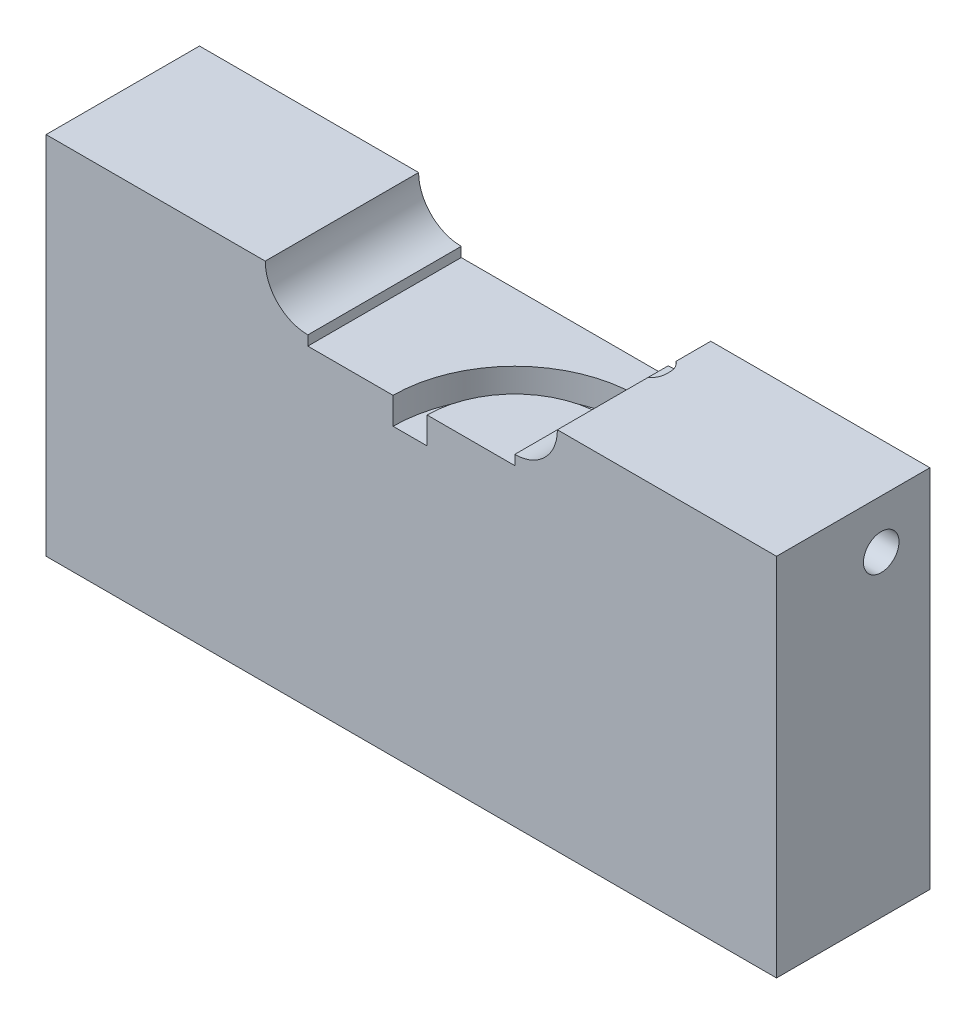
from build123d import *

# Parameters (mm, degrees)
SKETCH1_W               = 38.1
SKETCH1_H               = 8.001
BOSS_EXTRUDE1_DEPTH     = 19.05
CUT_EXTRUDE1_DEPTH      = 25.4
CUT_EXTRUDE2_DEPTH      = 26.730745355
CUT_EXTRUDE2_DEPTH_BACK = 1.905
SKETCH5_R               = 0.9271
CUT_EXTRUDE3_DEPTH      = 12.7
SKETCH6_W               = 10.795
SKETCH6_H               = 8.001
CUT_EXTRUDE4_DEPTH      = 0.508


with BuildPart() as part:
    # Sketch1 → Boss-Extrude1 (new body)
    with BuildSketch(Plane(origin=(0, 0, 0), x_dir=(1, 0, 0), z_dir=(0, 1, 0))):
        Rectangle(SKETCH1_W, SKETCH1_H)
    extrude(amount=BOSS_EXTRUDE1_DEPTH)

    # Sketch2 → Cut-Extrude1 (cut)
    with BuildSketch(Plane(origin=(0, 0, -4.0005), x_dir=(-1, 0, 0), z_dir=(0, 0, -1))):
        with BuildLine():
            Line((5.3975, 16.8275), (-5.3975, 16.8275))
            ThreePointArc((-5.3975, 16.8275), (-7.62, 19.05), (-5.3975, 21.2725))
            Line((-5.3975, 21.2725), (5.3975, 21.2725))
            ThreePointArc((5.3975, 21.2725), (7.62, 19.05), (5.3975, 16.8275))
        make_face()
    extrude(amount=-CUT_EXTRUDE1_DEPTH, mode=Mode.SUBTRACT)

    # Sketch4 → Cut-Extrude2 (cut, two sides: drawn at the far end of the back side and taken through both)
    with BuildSketch(Plane(origin=(0, 16.8275, 0), x_dir=(1, 0, 0), z_dir=(0, 1, 0)).offset(-CUT_EXTRUDE2_DEPTH_BACK)):
        with BuildLine():
            Line((0.8255, -4.0005), (-0.9525, -4.0005))
            ThreePointArc((-0.9525, -4.0005), (0.907371939, 0.489628061), (5.3975, 2.3495))
            Line((5.3975, 2.3495), (7.14375, 2.3495))
            ThreePointArc((7.14375, 2.3495), (7.705016008, 2.117016008), (7.9375, 1.55575))
            Line((7.9375, 1.55575), (7.9375, 1.36525))
            ThreePointArc((7.9375, 1.36525), (7.705016008, 0.803983992), (7.14375, 0.5715))
            Line((7.14375, 0.5715), (5.3975, 0.5715))
            ThreePointArc((5.3975, 0.5715), (2.164607796, -0.767607796), (0.8255, -4.0005))
        make_face()
    extrude(amount=CUT_EXTRUDE2_DEPTH + CUT_EXTRUDE2_DEPTH_BACK, mode=Mode.SUBTRACT)

    # Sketch5 → Cut-Extrude3 (cut)
    with BuildSketch(Plane(origin=(19.05, 0, 0), x_dir=(0, 0, -1), z_dir=(1, 0, 0))):
        with Locations((1.4605, 16.51)):
            Circle(SKETCH5_R)
    extrude(amount=-CUT_EXTRUDE3_DEPTH, mode=Mode.SUBTRACT)

    # Sketch6 → Cut-Extrude4 (cut)
    with BuildSketch(Plane(origin=(0, 16.8275, 0), x_dir=(1, 0, 0), z_dir=(0, 1, 0))):
        Rectangle(SKETCH6_W, SKETCH6_H)
    extrude(amount=-CUT_EXTRUDE4_DEPTH, mode=Mode.SUBTRACT)


solid = part.part
